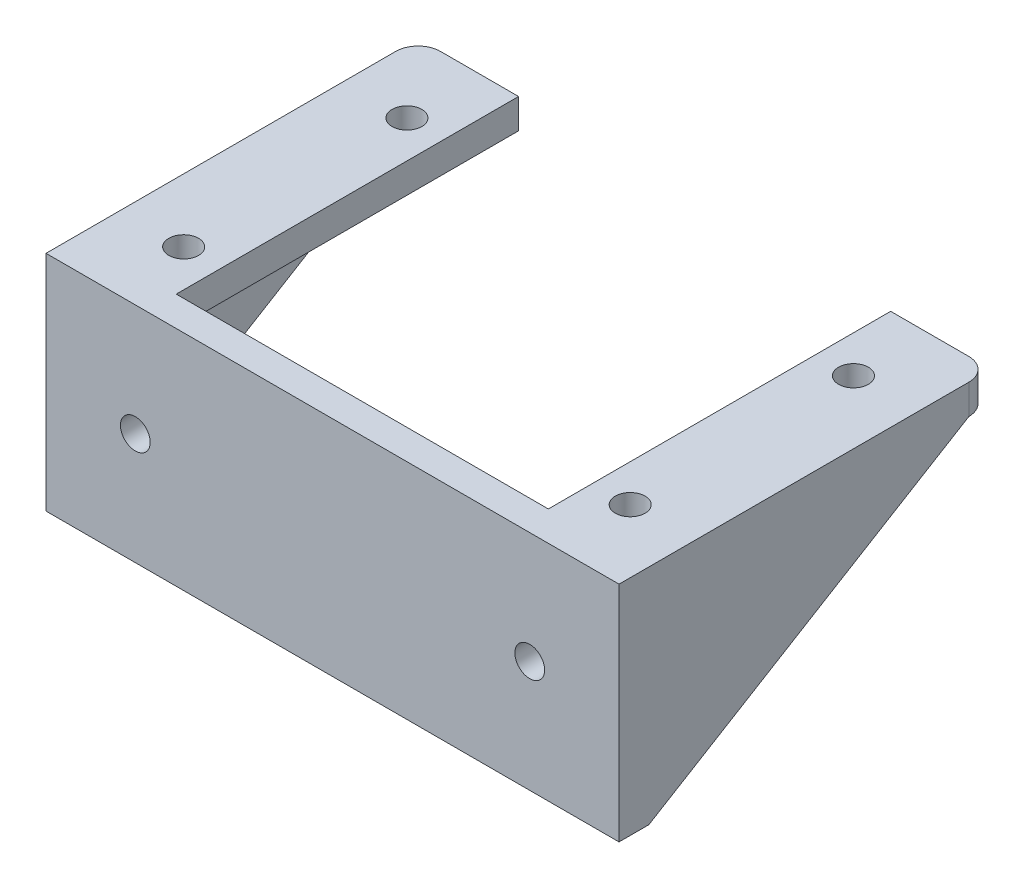
from build123d import *

# Parameters (mm, degrees)
SZKIC2_W                    = 77
SZKIC2_H                    = 50
DODANIE_WYCI_GNI_CIE2_DEPTH = 4
SZKIC4_W                    = 50
SZKIC4_H                    = 46
WYTNIJ_WYCI_GNI_CIE1_DEPTH  = 4
SZKIC5_W                    = 77
SZKIC5_H                    = 4
DODANIE_WYCI_GNI_CIE3_DEPTH = 26
WYTNIJ_WYCI_GNI_CIE2_REACH  = 70.251
SZKIC6_R                    = 2
ZAOKR_GLENIE1_R             = 3
DODANIE_WYCI_GNI_CIE4_DEPTH = 4
DODANIE_WYCI_GNI_CIE5_DEPTH = 4
WYTNIJ_WYCI_GNI_CIE5_REACH  = 56.838
SZKIC9_R                    = 2


with BuildPart() as part:
    # Szkic2 → Dodanie-wyciągnięcie2 (new body)
    with BuildSketch(Plane(origin=(0, 0, 0), x_dir=(1, 0, 0), z_dir=(0, 1, 0))):
        Rectangle(SZKIC2_W, SZKIC2_H)
    extrude(amount=DODANIE_WYCI_GNI_CIE2_DEPTH)

    # Szkic4 → Wytnij-wyciągnięcie1 (cut)
    with BuildSketch(Plane.XZ):
        with Locations((0, -2)):
            Rectangle(SZKIC4_W, SZKIC4_H)
    extrude(amount=-WYTNIJ_WYCI_GNI_CIE1_DEPTH, mode=Mode.SUBTRACT)

    # Szkic5 → Dodanie-wyciągnięcie3 (add)
    with BuildSketch(Plane.XZ):
        with Locations((0, 23)):
            Rectangle(SZKIC5_W, SZKIC5_H)
    extrude(amount=DODANIE_WYCI_GNI_CIE3_DEPTH)

    # Szkic6 → Wytnij-wyciągnięcie2 (cut, up to next)
    with BuildSketch(Plane.XY.offset(25), mode=Mode.PRIVATE) as wytnij_wyci_gni_cie2_sk1:
        with Locations((26.5, -11)):
            Circle(SZKIC6_R)
    wytnij_wyci_gni_cie2_tool1 = extrude(wytnij_wyci_gni_cie2_sk1.sketch, amount=-WYTNIJ_WYCI_GNI_CIE2_REACH, mode=Mode.PRIVATE) & part.part
    # Szkic6 → Wytnij-wyciągnięcie2 (cut, up to next)
    with BuildSketch(Plane.XY.offset(25), mode=Mode.PRIVATE) as wytnij_wyci_gni_cie2_sk2:
        with Locations((-26.5, -11)):
            Circle(SZKIC6_R)
    wytnij_wyci_gni_cie2_tool2 = extrude(wytnij_wyci_gni_cie2_sk2.sketch, amount=-WYTNIJ_WYCI_GNI_CIE2_REACH, mode=Mode.PRIVATE) & part.part
    add(wytnij_wyci_gni_cie2_tool1.solids().sort_by_distance((26.5, -11, 25))[0], mode=Mode.SUBTRACT)
    add(wytnij_wyci_gni_cie2_tool2.solids().sort_by_distance((-26.5, -11, 25))[0], mode=Mode.SUBTRACT)

    # Zaokrąglenie1
    zaokr_glenie1_edges = [part.edges().sort_by_distance(p)[0] for p in [
        (-38.5, 2, -25),
        (38.5, 2, -25),
    ]]
    fillet(zaokr_glenie1_edges, radius=ZAOKR_GLENIE1_R)

    # Szkic7 → Dodanie-wyciągnięcie4 (add)
    with BuildSketch(Plane.ZY.offset(38.5)):
        Polygon((21, -26), (21, 0), (-22, 0), align=None)
    extrude(amount=-DODANIE_WYCI_GNI_CIE4_DEPTH)

    # Szkic8 → Dodanie-wyciągnięcie5 (add)
    with BuildSketch(Plane(origin=(38.5, 0, 0), x_dir=(0, 0, -1), z_dir=(1, 0, 0))):
        Polygon((-21, -26), (22, 0), (-21, 0), align=None)
    extrude(amount=-DODANIE_WYCI_GNI_CIE5_DEPTH)

    # Szkic9 → Wytnij-wyciągnięcie5 (cut, up to next)
    with BuildSketch(Plane(origin=(0, 4, 0), x_dir=(1, 0, 0), z_dir=(0, 1, 0)), mode=Mode.PRIVATE) as wytnij_wyci_gni_cie5_sk1:
        with Locations(Location((-30, 15, 0), (0, 0, 270))):
            Circle(SZKIC9_R)
    wytnij_wyci_gni_cie5_tool1 = extrude(wytnij_wyci_gni_cie5_sk1.sketch, amount=-WYTNIJ_WYCI_GNI_CIE5_REACH, mode=Mode.PRIVATE) & part.part
    # Szkic9 → Wytnij-wyciągnięcie5 (cut, up to next)
    with BuildSketch(Plane(origin=(0, 4, 0), x_dir=(1, 0, 0), z_dir=(0, 1, 0)), mode=Mode.PRIVATE) as wytnij_wyci_gni_cie5_sk2:
        with Locations(Location((-30, -15, 0), (0, 0, 270))):
            Circle(SZKIC9_R)
    wytnij_wyci_gni_cie5_tool2 = extrude(wytnij_wyci_gni_cie5_sk2.sketch, amount=-WYTNIJ_WYCI_GNI_CIE5_REACH, mode=Mode.PRIVATE) & part.part
    # Szkic9 → Wytnij-wyciągnięcie5 (cut, up to next)
    with BuildSketch(Plane(origin=(0, 4, 0), x_dir=(1, 0, 0), z_dir=(0, 1, 0)), mode=Mode.PRIVATE) as wytnij_wyci_gni_cie5_sk3:
        with Locations(Location((30, 15, 0), (0, 0, 270))):
            Circle(SZKIC9_R)
    wytnij_wyci_gni_cie5_tool3 = extrude(wytnij_wyci_gni_cie5_sk3.sketch, amount=-WYTNIJ_WYCI_GNI_CIE5_REACH, mode=Mode.PRIVATE) & part.part
    # Szkic9 → Wytnij-wyciągnięcie5 (cut, up to next)
    with BuildSketch(Plane(origin=(0, 4, 0), x_dir=(1, 0, 0), z_dir=(0, 1, 0)), mode=Mode.PRIVATE) as wytnij_wyci_gni_cie5_sk4:
        with Locations(Location((30, -15, 0), (0, 0, 270))):
            Circle(SZKIC9_R)
    wytnij_wyci_gni_cie5_tool4 = extrude(wytnij_wyci_gni_cie5_sk4.sketch, amount=-WYTNIJ_WYCI_GNI_CIE5_REACH, mode=Mode.PRIVATE) & part.part
    add(wytnij_wyci_gni_cie5_tool1.solids().sort_by_distance((-30, 4, -15))[0], mode=Mode.SUBTRACT)
    add(wytnij_wyci_gni_cie5_tool2.solids().sort_by_distance((-30, 4, 15))[0], mode=Mode.SUBTRACT)
    add(wytnij_wyci_gni_cie5_tool3.solids().sort_by_distance((30, 4, -15))[0], mode=Mode.SUBTRACT)
    add(wytnij_wyci_gni_cie5_tool4.solids().sort_by_distance((30, 4, 15))[0], mode=Mode.SUBTRACT)


solid = part.part
